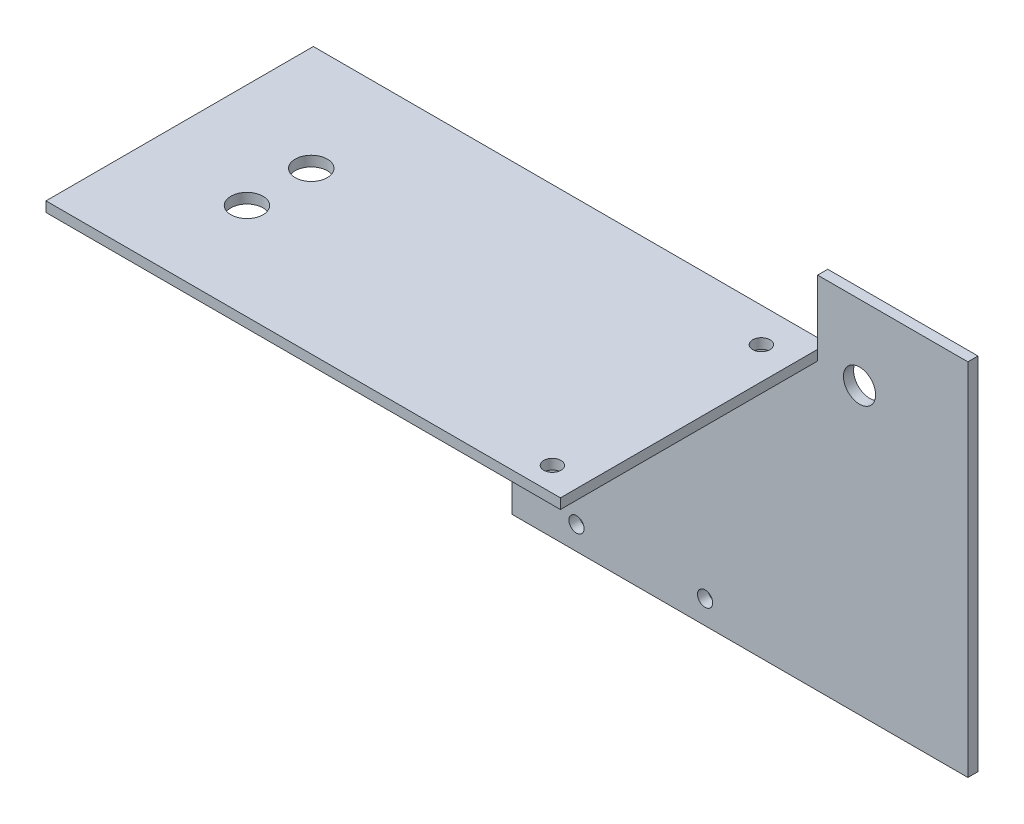
from build123d import *

# Parameters (mm, degrees)
SKETCH1_R           = 3.175
SKETCH1_R_2         = 1.5
BOSS_EXTRUDE1_DEPTH = 2
BOSS_EXTRUDE2_DEPTH = 52.8
SKETCH3_R           = 1.7
SKETCH3_R_2         = 3.175
CUT_EXTRUDE1_DEPTH  = 119.706360402


with BuildPart() as part:
    # Sketch1 → Boss-Extrude1 (new body)
    with BuildSketch(Plane.XY):
        Polygon((0, 58.4), (60.325, 58.4), (60.325, 71.1), (90, 71.1), (90, 58.4), (90, 0), (0, 0), align=None)
        with Locations((68.6, 56.33204182)):
            Circle(SKETCH1_R, mode=Mode.SUBTRACT)
        with Locations((12.7, 51.75)):
            Circle(SKETCH1_R_2, mode=Mode.SUBTRACT)
        with Locations((38.1, 51.75)):
            Circle(SKETCH1_R_2, mode=Mode.SUBTRACT)
        with Locations((12.7, 4.65)):
            Circle(SKETCH1_R_2, mode=Mode.SUBTRACT)
        with Locations((38.1, 4.65)):
            Circle(SKETCH1_R_2, mode=Mode.SUBTRACT)
    extrude(amount=-BOSS_EXTRUDE1_DEPTH)

    # Sketch2 → Boss-Extrude2 (add)
    with BuildSketch(Plane(origin=(0, 0, -2), x_dir=(-1, 0, 0), z_dir=(0, 0, -1))):
        Polygon((0, 56.4), (41.275, 56.4), (41.275, 58.4), (0, 58.4), (-60.325, 58.4), (-60.325, 56.4), align=None)
    extrude(amount=-BOSS_EXTRUDE2_DEPTH)

    # Sketch3 → Cut-Extrude1 (cut, through all)
    with BuildSketch(Plane(origin=(0, 58.4, 0), x_dir=(1, 0, 0), z_dir=(0, 1, 0))):
        with Locations(Location((53.975, -4.7625, 0), (0, 0, 270))):
            Circle(SKETCH3_R)
        with Locations(Location((53.975, -46.0375, 0), (0, 0, 270))):
            Circle(SKETCH3_R)
        with Locations(Location((-20.6375, -31.75, 0), (0, 0, 270))):
            Circle(SKETCH3_R_2)
        with Locations(Location((-20.6375, -19.05, 0), (0, 0, 270))):
            Circle(SKETCH3_R_2)
    extrude(amount=-CUT_EXTRUDE1_DEPTH, mode=Mode.SUBTRACT)


solid = part.part
